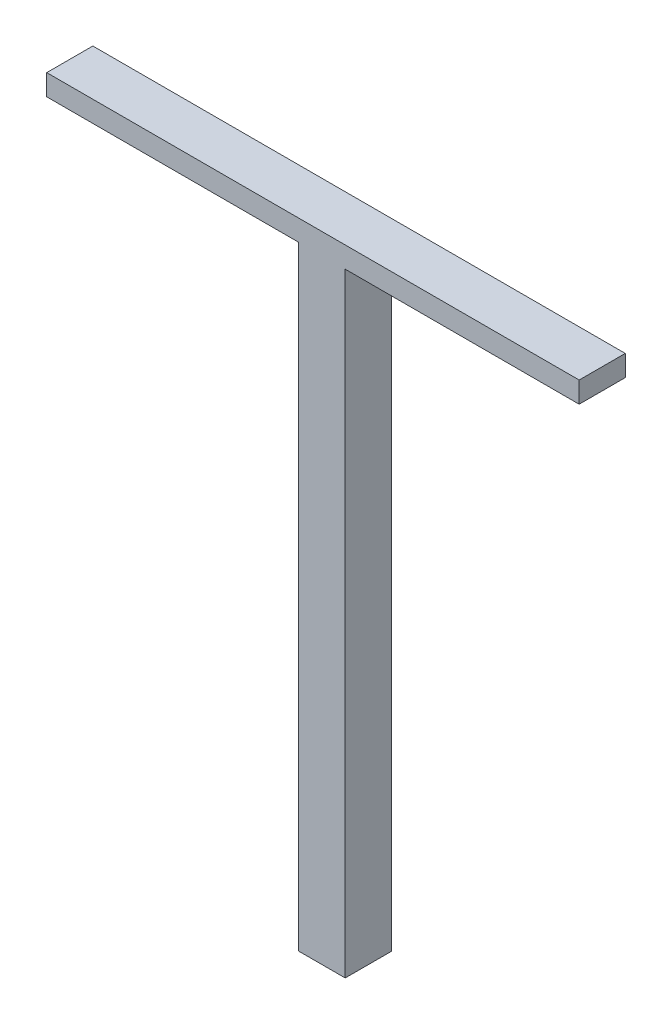
from build123d import *

# Parameters (mm, degrees)
EXTRUDE_1_DEPTH = 40


with BuildPart() as part:
    # Эскиз1 → Бобышка-Вытянуть1 (new body)
    with BuildSketch(Plane.XY):
        Polygon((-73.895134276, 42.921301764), (388.168111391, 42.921301764), (388.168111391, 24.71840833), (185.133360285, 24.71840833), (185.133360285, -508.025026424), (144.415139044, -508.025026424), (144.415139044, 24.71840833), (-73.895134276, 24.71840833), align=None)
    extrude(amount=EXTRUDE_1_DEPTH)


solid = part.part
